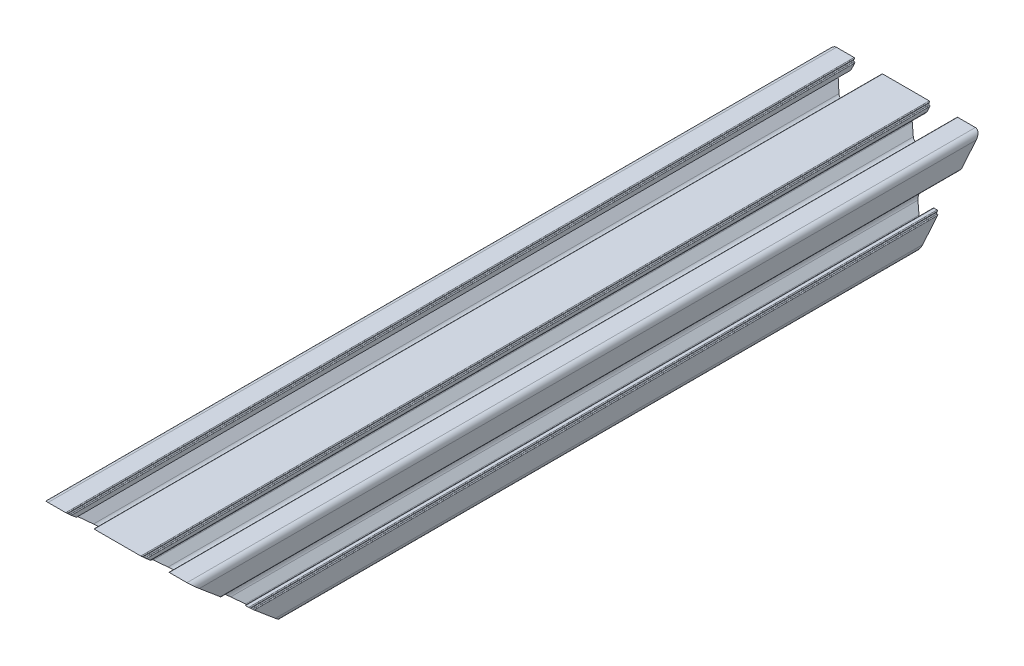
from build123d import *

# Parameters (mm, degrees)
SKETCH1_R           = 2.5
BOSS_EXTRUDE2_DEPTH = 400
CUT_EXTRUDE1_DEPTH  = 90


with BuildPart() as part:
    # Sketch1 → Boss-Extrude2 (new body)
    with BuildSketch(Plane.XY):
        with BuildLine():
            Line((1.5, 0), (6.2, 0))
            ThreePointArc((6.2, 0), (6.341421356, 0.058578644), (6.4, 0.2))
            Line((6.4, 0.2), (6.4, 0.3))
            ThreePointArc((6.4, 0.3), (6.458578644, 0.441421356), (6.6, 0.5))
            Line((6.6, 0.5), (6.7, 0.5))
            ThreePointArc((6.7, 0.5), (6.841421356, 0.558578644), (6.9, 0.7))
            Line((6.9, 0.7), (6.9, 1.5))
            ThreePointArc((6.9, 1.5), (6.812132034, 1.712132034), (6.6, 1.8))
            Line((6.6, 1.8), (4.8, 1.8))
            ThreePointArc((4.8, 1.8), (4.587867966, 1.887867966), (4.5, 2.1))
            Line((4.5, 2.1), (4.5, 2.818019485))
            ThreePointArc((4.5, 2.818019485), (4.614180701, 3.392044633), (4.939339828, 3.878679656))
            Line((4.939339828, 3.878679656), (6.721320344, 5.660660172))
            ThreePointArc((6.721320344, 5.660660172), (7.207955367, 5.985819299), (7.781980515, 6.1))
            Line((7.781980515, 6.1), (12.218019485, 6.1))
            ThreePointArc((12.218019485, 6.1), (12.792044633, 5.985819299), (13.278679656, 5.660660172))
            Line((13.278679656, 5.660660172), (15.060660172, 3.878679656))
            ThreePointArc((15.060660172, 3.878679656), (15.385819299, 3.392044633), (15.5, 2.818019485))
            Line((15.5, 2.818019485), (15.5, 2.1))
            ThreePointArc((15.5, 2.1), (15.412132034, 1.887867966), (15.2, 1.8))
            Line((15.2, 1.8), (13.4, 1.8))
            ThreePointArc((13.4, 1.8), (13.187867966, 1.712132034), (13.1, 1.5))
            Line((13.1, 1.5), (13.1, 0.7))
            ThreePointArc((13.1, 0.7), (13.158578644, 0.558578644), (13.3, 0.5))
            Line((13.3, 0.5), (13.4, 0.5))
            ThreePointArc((13.4, 0.5), (13.541421356, 0.441421356), (13.6, 0.3))
            Line((13.6, 0.3), (13.6, 0.2))
            ThreePointArc((13.6, 0.2), (13.658578644, 0.058578644), (13.8, 0))
            Line((13.8, 0), (26.2, 0))
            ThreePointArc((26.2, 0), (26.341421356, 0.058578644), (26.4, 0.2))
            Line((26.4, 0.2), (26.4, 0.3))
            ThreePointArc((26.4, 0.3), (26.458578644, 0.441421356), (26.6, 0.5))
            Line((26.6, 0.5), (26.7, 0.5))
            ThreePointArc((26.7, 0.5), (26.841421356, 0.558578644), (26.9, 0.7))
            Line((26.9, 0.7), (26.9, 1.5))
            ThreePointArc((26.9, 1.5), (26.812132034, 1.712132034), (26.6, 1.8))
            Line((26.6, 1.8), (24.8, 1.8))
            ThreePointArc((24.8, 1.8), (24.587867966, 1.887867966), (24.5, 2.1))
            Line((24.5, 2.1), (24.5, 2.818019485))
            ThreePointArc((24.5, 2.818019485), (24.614180701, 3.392044633), (24.939339828, 3.878679656))
            Line((24.939339828, 3.878679656), (26.721320344, 5.660660172))
            ThreePointArc((26.721320344, 5.660660172), (27.207955367, 5.985819299), (27.781980515, 6.1))
            Line((27.781980515, 6.1), (32.218019485, 6.1))
            ThreePointArc((32.218019485, 6.1), (32.792044633, 5.985819299), (33.278679656, 5.660660172))
            Line((33.278679656, 5.660660172), (35.060660172, 3.878679656))
            ThreePointArc((35.060660172, 3.878679656), (35.385819299, 3.392044633), (35.5, 2.818019485))
            Line((35.5, 2.818019485), (35.5, 2.1))
            ThreePointArc((35.5, 2.1), (35.412132034, 1.887867966), (35.2, 1.8))
            Line((35.2, 1.8), (33.4, 1.8))
            ThreePointArc((33.4, 1.8), (33.187867966, 1.712132034), (33.1, 1.5))
            Line((33.1, 1.5), (33.1, 0.7))
            ThreePointArc((33.1, 0.7), (33.158578644, 0.558578644), (33.3, 0.5))
            Line((33.3, 0.5), (33.4, 0.5))
            ThreePointArc((33.4, 0.5), (33.541421356, 0.441421356), (33.6, 0.3))
            Line((33.6, 0.3), (33.6, 0.2))
            ThreePointArc((33.6, 0.2), (33.658578644, 0.058578644), (33.8, 0))
            Line((33.8, 0), (38.5, 0))
            ThreePointArc((38.5, 0), (39.560660172, 0.439339828), (40, 1.5))
            Line((40, 1.5), (40, 6.2))
            ThreePointArc((40, 6.2), (39.941421356, 6.341421356), (39.8, 6.4))
            Line((39.8, 6.4), (39.7, 6.4))
            ThreePointArc((39.7, 6.4), (39.558578644, 6.458578644), (39.5, 6.6))
            Line((39.5, 6.6), (39.5, 6.7))
            ThreePointArc((39.5, 6.7), (39.441421356, 6.841421356), (39.3, 6.9))
            Line((39.3, 6.9), (38.5, 6.9))
            ThreePointArc((38.5, 6.9), (38.287867966, 6.812132034), (38.2, 6.6))
            Line((38.2, 6.6), (38.2, 4.8))
            ThreePointArc((38.2, 4.8), (38.112132034, 4.587867966), (37.9, 4.5))
            Line((37.9, 4.5), (37.181980515, 4.5))
            ThreePointArc((37.181980515, 4.5), (36.607955367, 4.614180701), (36.121320344, 4.939339828))
            Line((36.121320344, 4.939339828), (34.339339828, 6.721320344))
            ThreePointArc((34.339339828, 6.721320344), (34.014180701, 7.207955367), (33.9, 7.781980515))
            Line((33.9, 7.781980515), (33.9, 12.218019485))
            ThreePointArc((33.9, 12.218019485), (34.014180701, 12.792044633), (34.339339828, 13.278679656))
            Line((34.339339828, 13.278679656), (36.121320344, 15.060660172))
            ThreePointArc((36.121320344, 15.060660172), (36.607955367, 15.385819299), (37.181980515, 15.5))
            Line((37.181980515, 15.5), (37.9, 15.5))
            ThreePointArc((37.9, 15.5), (38.112132034, 15.412132034), (38.2, 15.2))
            Line((38.2, 15.2), (38.2, 13.4))
            ThreePointArc((38.2, 13.4), (38.287867966, 13.187867966), (38.5, 13.1))
            Line((38.5, 13.1), (39.3, 13.1))
            ThreePointArc((39.3, 13.1), (39.441421356, 13.158578644), (39.5, 13.3))
            Line((39.5, 13.3), (39.5, 13.4))
            ThreePointArc((39.5, 13.4), (39.558578644, 13.541421356), (39.7, 13.6))
            Line((39.7, 13.6), (39.8, 13.6))
            ThreePointArc((39.8, 13.6), (39.941421356, 13.658578644), (40, 13.8))
            Line((40, 13.8), (40, 18.5))
            ThreePointArc((40, 18.5), (39.560660172, 19.560660172), (38.5, 20))
            Line((38.5, 20), (33.8, 20))
            ThreePointArc((33.8, 20), (33.658578644, 19.941421356), (33.6, 19.8))
            Line((33.6, 19.8), (33.6, 19.7))
            ThreePointArc((33.6, 19.7), (33.541421356, 19.558578644), (33.4, 19.5))
            Line((33.4, 19.5), (33.3, 19.5))
            ThreePointArc((33.3, 19.5), (33.158578644, 19.441421356), (33.1, 19.3))
            Line((33.1, 19.3), (33.1, 18.5))
            ThreePointArc((33.1, 18.5), (33.187867966, 18.287867966), (33.4, 18.2))
            Line((33.4, 18.2), (35.2, 18.2))
            ThreePointArc((35.2, 18.2), (35.412132034, 18.112132034), (35.5, 17.9))
            Line((35.5, 17.9), (35.5, 17.181980515))
            ThreePointArc((35.5, 17.181980515), (35.385819299, 16.607955367), (35.060660172, 16.121320344))
            Line((35.060660172, 16.121320344), (33.278679656, 14.339339828))
            ThreePointArc((33.278679656, 14.339339828), (32.792044633, 14.014180701), (32.218019485, 13.9))
            Line((32.218019485, 13.9), (27.781980515, 13.9))
            ThreePointArc((27.781980515, 13.9), (27.207955367, 14.014180701), (26.721320344, 14.339339828))
            Line((26.721320344, 14.339339828), (24.939339828, 16.121320344))
            ThreePointArc((24.939339828, 16.121320344), (24.614180701, 16.607955367), (24.5, 17.181980515))
            Line((24.5, 17.181980515), (24.5, 17.9))
            ThreePointArc((24.5, 17.9), (24.587867966, 18.112132034), (24.8, 18.2))
            Line((24.8, 18.2), (26.6, 18.2))
            ThreePointArc((26.6, 18.2), (26.812132034, 18.287867966), (26.9, 18.5))
            Line((26.9, 18.5), (26.9, 19.3))
            ThreePointArc((26.9, 19.3), (26.841421356, 19.441421356), (26.7, 19.5))
            Line((26.7, 19.5), (26.6, 19.5))
            ThreePointArc((26.6, 19.5), (26.458578644, 19.558578644), (26.4, 19.7))
            Line((26.4, 19.7), (26.4, 19.8))
            ThreePointArc((26.4, 19.8), (26.341421356, 19.941421356), (26.2, 20))
            Line((26.2, 20), (13.8, 20))
            ThreePointArc((13.8, 20), (13.658578644, 19.941421356), (13.6, 19.8))
            Line((13.6, 19.8), (13.6, 19.7))
            ThreePointArc((13.6, 19.7), (13.541421356, 19.558578644), (13.4, 19.5))
            Line((13.4, 19.5), (13.3, 19.5))
            ThreePointArc((13.3, 19.5), (13.158578644, 19.441421356), (13.1, 19.3))
            Line((13.1, 19.3), (13.1, 18.2))
            Line((13.1, 18.2), (15.3, 18.2))
            ThreePointArc((15.3, 18.2), (15.512132034, 18.112132034), (15.6, 17.9))
            Line((15.6, 17.9), (15.6, 17.281980515))
            ThreePointArc((15.6, 17.281980515), (15.485819299, 16.707955367), (15.160660172, 16.221320344))
            Line((15.160660172, 16.221320344), (13.278679656, 14.339339828))
            ThreePointArc((13.278679656, 14.339339828), (12.792044633, 14.014180701), (12.218019485, 13.9))
            Line((12.218019485, 13.9), (7.986375635, 13.9))
            ThreePointArc((7.986375635, 13.9), (7.393381044, 14.022191082), (6.896997987, 14.36885678))
            Line((6.896997987, 14.36885678), (4.910622352, 16.467414163))
            ThreePointArc((4.910622352, 16.467414163), (4.606431474, 16.943609851), (4.5, 17.498557383))
            Line((4.5, 17.498557383), (4.5, 17.9))
            ThreePointArc((4.5, 17.9), (4.587867966, 18.112132034), (4.8, 18.2))
            Line((4.8, 18.2), (6.9, 18.2))
            Line((6.9, 18.2), (6.9, 19.3))
            ThreePointArc((6.9, 19.3), (6.841421356, 19.441421356), (6.7, 19.5))
            Line((6.7, 19.5), (6.6, 19.5))
            ThreePointArc((6.6, 19.5), (6.458578644, 19.558578644), (6.4, 19.7))
            Line((6.4, 19.7), (6.4, 19.8))
            ThreePointArc((6.4, 19.8), (6.341421356, 19.941421356), (6.2, 20))
            Line((6.2, 20), (1.5, 20))
            ThreePointArc((1.5, 20), (0.439339828, 19.560660172), (0, 18.5))
            Line((0, 18.5), (0, 13.8))
            ThreePointArc((0, 13.8), (0.058578644, 13.658578644), (0.2, 13.6))
            Line((0.2, 13.6), (0.3, 13.6))
            ThreePointArc((0.3, 13.6), (0.441421356, 13.541421356), (0.5, 13.4))
            Line((0.5, 13.4), (0.5, 13.3))
            ThreePointArc((0.5, 13.3), (0.558578644, 13.158578644), (0.7, 13.1))
            Line((0.7, 13.1), (1.5, 13.1))
            ThreePointArc((1.5, 13.1), (1.712132034, 13.187867966), (1.8, 13.4))
            Line((1.8, 13.4), (1.8, 15.2))
            ThreePointArc((1.8, 15.2), (1.887867966, 15.412132034), (2.1, 15.5))
            Line((2.1, 15.5), (2.818019485, 15.5))
            ThreePointArc((2.818019485, 15.5), (3.392044633, 15.385819299), (3.878679656, 15.060660172))
            Line((3.878679656, 15.060660172), (5.660660172, 13.278679656))
            ThreePointArc((5.660660172, 13.278679656), (5.985819299, 12.792044633), (6.1, 12.218019485))
            Line((6.1, 12.218019485), (6.1, 7.781980515))
            ThreePointArc((6.1, 7.781980515), (5.985819299, 7.207955367), (5.660660172, 6.721320344))
            Line((5.660660172, 6.721320344), (3.878679656, 4.939339828))
            ThreePointArc((3.878679656, 4.939339828), (3.392044633, 4.614180701), (2.818019485, 4.5))
            Line((2.818019485, 4.5), (2.1, 4.5))
            ThreePointArc((2.1, 4.5), (1.887867966, 4.587867966), (1.8, 4.8))
            Line((1.8, 4.8), (1.8, 6.6))
            ThreePointArc((1.8, 6.6), (1.712132034, 6.812132034), (1.5, 6.9))
            Line((1.5, 6.9), (0.7, 6.9))
            ThreePointArc((0.7, 6.9), (0.558578644, 6.841421356), (0.5, 6.7))
            Line((0.5, 6.7), (0.5, 6.6))
            ThreePointArc((0.5, 6.6), (0.441421356, 6.458578644), (0.3, 6.4))
            Line((0.3, 6.4), (0.2, 6.4))
            ThreePointArc((0.2, 6.4), (0.058578644, 6.341421356), (0, 6.2))
            Line((0, 6.2), (0, 1.5))
            ThreePointArc((0, 1.5), (0.439339828, 0.439339828), (1.5, 0))
        make_face()
        with Locations((10, 10)):
            Circle(SKETCH1_R, mode=Mode.SUBTRACT)
        with Locations((30, 10)):
            Circle(SKETCH1_R, mode=Mode.SUBTRACT)
        with BuildLine():
            Line((17.6, 1.8), (22.4, 1.8))
            ThreePointArc((22.4, 1.8), (22.612132034, 1.887867966), (22.7, 2.1))
            Line((22.7, 2.1), (22.7, 3.139339828))
            ThreePointArc((22.7, 3.139339828), (22.814180701, 3.713364977), (23.139339828, 4.2))
            Line((23.139339828, 4.2), (25.660660172, 6.721320344))
            ThreePointArc((25.660660172, 6.721320344), (25.985819299, 7.207955367), (26.1, 7.781980515))
            Line((26.1, 7.781980515), (26.1, 12.218019485))
            ThreePointArc((26.1, 12.218019485), (25.985819299, 12.792044633), (25.660660172, 13.278679656))
            Line((25.660660172, 13.278679656), (23.139339828, 15.8))
            ThreePointArc((23.139339828, 15.8), (22.814180701, 16.286635023), (22.7, 16.860660172))
            Line((22.7, 16.860660172), (22.7, 17.9))
            ThreePointArc((22.7, 17.9), (22.612132034, 18.112132034), (22.4, 18.2))
            Line((22.4, 18.2), (17.6, 18.2))
            ThreePointArc((17.6, 18.2), (17.387867966, 18.112132034), (17.3, 17.9))
            Line((17.3, 17.9), (17.3, 16.860660172))
            ThreePointArc((17.3, 16.860660172), (17.185819299, 16.286635023), (16.860660172, 15.8))
            Line((16.860660172, 15.8), (14.339339828, 13.278679656))
            ThreePointArc((14.339339828, 13.278679656), (14.014180701, 12.792044633), (13.9, 12.218019485))
            Line((13.9, 12.218019485), (13.9, 7.781980515))
            ThreePointArc((13.9, 7.781980515), (14.014180701, 7.207955367), (14.339339828, 6.721320344))
            Line((14.339339828, 6.721320344), (16.860660172, 4.2))
            ThreePointArc((16.860660172, 4.2), (17.185819299, 3.713364977), (17.3, 3.139339828))
            Line((17.3, 3.139339828), (17.3, 2.1))
            ThreePointArc((17.3, 2.1), (17.387867966, 1.887867966), (17.6, 1.8))
        make_face(mode=Mode.SUBTRACT)
    extrude(amount=BOSS_EXTRUDE2_DEPTH)

    # Sketch4 → Cut-Extrude1 (cut)
    with BuildSketch(Plane(origin=(40, 0, 0), x_dir=(0, 0, -1), z_dir=(1, 0, 0))):
        Polygon((-112.520922489, 51.825435767), (-131.221534004, 20), (-132.480183451, 18.5), (0, 18.5), (0, 13.8), (-136.423951718, 13.8), (-148.003526628, 0), (-140.995828005, -14.235201256), (-140.995828005, -57.824200398), (-4.996279272, -57.824200398), (39.203574065, -8.524363982), (9.45367278, 62.025401922), (-58.971100176, 72.225368077), align=None)
        Polygon((-339.433903615, 18.5), (-341.221534004, 20), (-358.528081315, 43.088156449), (-373.248433862, 40.954772022), (-418.006057939, 34.468159837), (-410.94759981, -14.235201256), (-349.87480766, -23.686776117), (-317.386462152, 0), (-333.83266173, 13.8), (-400, 13.8), (-400, 18.5), align=None)
        Polygon((-333.83266173, 13.8), (-339.433903615, 18.5), (-400, 18.5), (-400, 13.8), align=None)
        Polygon((0, 18.5), (-132.480183451, 18.5), (-136.423951718, 13.8), (0, 13.8), align=None)
    extrude(amount=-CUT_EXTRUDE1_DEPTH, mode=Mode.SUBTRACT)


solid = part.part
